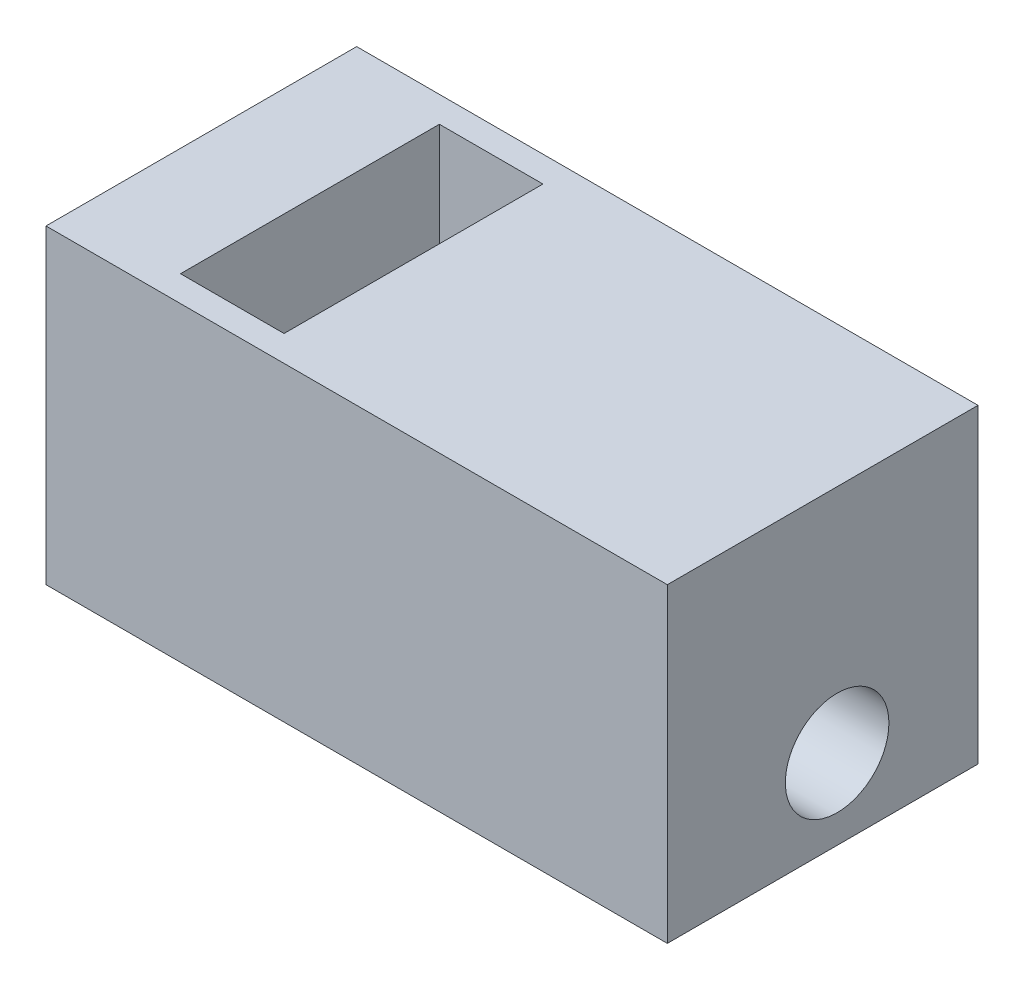
from build123d import *

# Parameters (mm, degrees)
SKETCH1_W           = 152.4
SKETCH1_H           = 76.2
BOSS_EXTRUDE1_DEPTH = 76.2
SKETCH2_R           = 12.7
CUT_EXTRUDE1_DEPTH  = 176.059416041
SKETCH3_W           = 25.4
SKETCH3_H           = 63.5
CUT_EXTRUDE2_DEPTH  = 25.4


with BuildPart() as part:
    # Sketch1 → Boss-Extrude1 (new body)
    with BuildSketch(Plane(origin=(0, 0, 0), x_dir=(1, 0, 0), z_dir=(0, 1, 0))):
        with Locations((13.452592593, -2.06962963)):
            Rectangle(SKETCH1_W, SKETCH1_H)
    extrude(amount=BOSS_EXTRUDE1_DEPTH)

    # Sketch2 → Cut-Extrude1 (cut, through all)
    with BuildSketch(Plane(origin=(89.652592593, 0, 0), x_dir=(0, 0, -1), z_dir=(1, 0, 0))):
        with Locations((1.478173536, 19.632815924)):
            Circle(SKETCH2_R)
    extrude(amount=-CUT_EXTRUDE1_DEPTH, mode=Mode.SUBTRACT)

    # Sketch3 → Cut-Extrude2 (cut)
    with BuildSketch(Plane(origin=(0, 76.2, 0), x_dir=(1, 0, 0), z_dir=(0, 1, 0))):
        with Locations((-23.407128425, -2.06962963)):
            Rectangle(SKETCH3_W, SKETCH3_H)
    extrude(amount=-CUT_EXTRUDE2_DEPTH, mode=Mode.SUBTRACT)


solid = part.part
